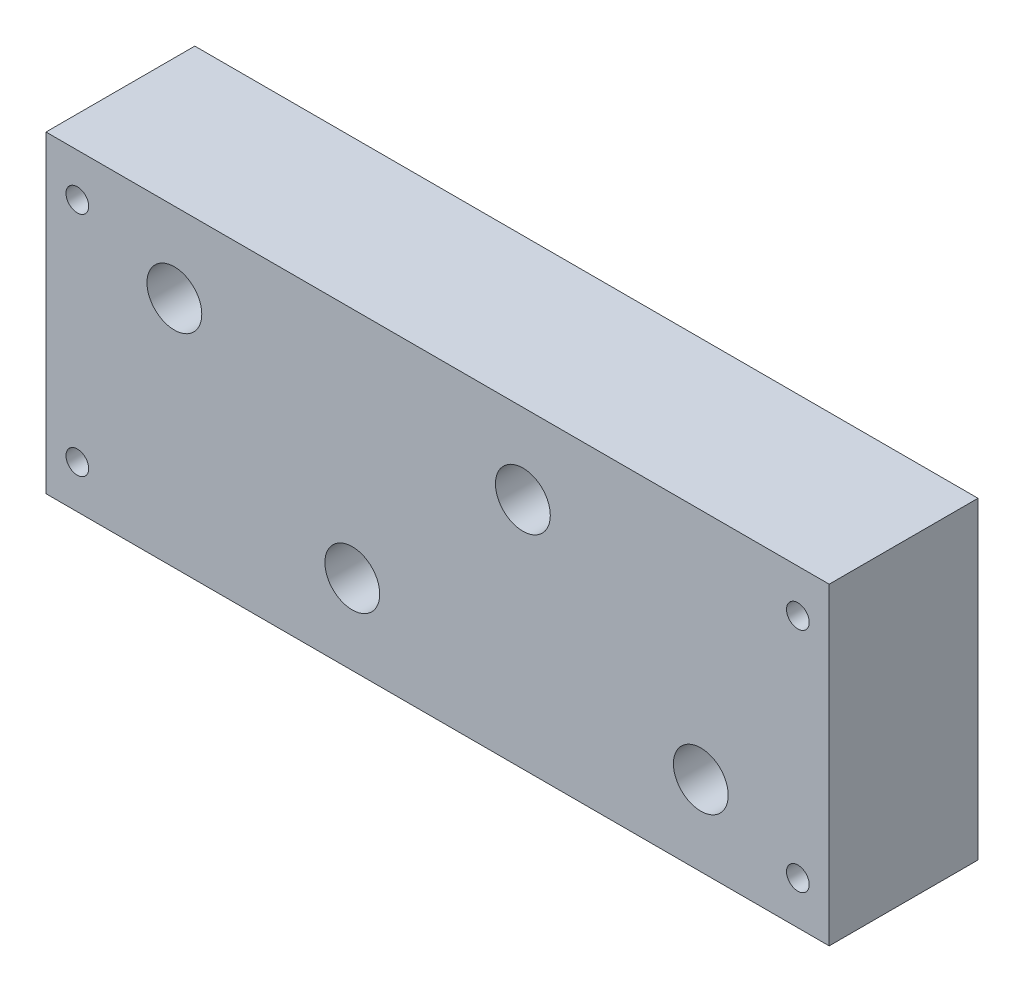
from build123d import *

# Parameters (mm, degrees)
SKETCH1_W           = 100
SKETCH1_H           = 40
BOSS_EXTRUDE1_DEPTH = 38
CUT_EXTRUDE2_START  = -12
SKETCH2_W           = 39.5
SKETCH2_H           = 34
CUT_EXTRUDE2_DEPTH  = 21
CUT_EXTRUDE3_DEPTH  = 9
CUT_EXTRUDE4_REACH  = 81.36
SKETCH4_R           = 1.45
SKETCH5_W           = 100
SKETCH5_H           = 19
CUT_EXTRUDE5_DEPTH  = 87.215210375
FILLET1_R           = 0.5
CUT_EXTRUDE11_REACH = 73.063
SKETCH10_R          = 3.5


with BuildPart() as part:
    # Sketch1 → Boss-Extrude1 (new body)
    with BuildSketch(Plane.XY):
        with Locations((16.25, 1.5625)):
            Rectangle(SKETCH1_W, SKETCH1_H)
    extrude(amount=BOSS_EXTRUDE1_DEPTH)

    # Sketch2 → Cut-Extrude2 (cut)
    with BuildSketch(Plane(origin=(0, 0, 0), x_dir=(-1, 0, 0), z_dir=(0, 0, -1)).offset(CUT_EXTRUDE2_START)):
        with Locations((-38.5, 1.5625)):
            Rectangle(SKETCH2_W, SKETCH2_H)
        with Locations((6, 1.5625)):
            Rectangle(SKETCH2_W, SKETCH2_H)
    extrude(amount=-CUT_EXTRUDE2_DEPTH, mode=Mode.SUBTRACT)

    # Sketch3 → Cut-Extrude3 (cut)
    with BuildSketch(Plane(origin=(-3.362318072, 0, 0), x_dir=(-1, 0, 0), z_dir=(0, 0, -1))):
        with BuildLine():
            ThreePointArc((-61.593370612, 1.614325749), (-20.676836723, -17.421621422), (21.715969185, -1.949710178))
            ThreePointArc((21.715969185, -1.949710178), (22.204299442, 9.465009595), (10.78957967, 9.953339852))
            ThreePointArc((10.78957967, 9.953339852), (-19.986233449, -1.278769909), (-49.690320582, 12.540715264))
            ThreePointArc((-49.690320582, 12.540715264), (-61.105040355, 13.029045522), (-61.593370612, 1.614325749))
        make_face()
    extrude(amount=-CUT_EXTRUDE3_DEPTH, mode=Mode.SUBTRACT)

    # Sketch4 → Cut-Extrude4 (cut, up to next)
    with BuildSketch(Plane(origin=(0, 0, 0), x_dir=(-1, 0, 0), z_dir=(0, 0, -1)), mode=Mode.PRIVATE) as cut_extrude4_sk1:
        with Locations((-62.25, 16.0625)):
            Circle(SKETCH4_R)
    cut_extrude4_tool1 = extrude(cut_extrude4_sk1.sketch, amount=-CUT_EXTRUDE4_REACH, mode=Mode.PRIVATE) & part.part
    # Sketch4 → Cut-Extrude4 (cut, up to next)
    with BuildSketch(Plane(origin=(0, 0, 0), x_dir=(-1, 0, 0), z_dir=(0, 0, -1)), mode=Mode.PRIVATE) as cut_extrude4_sk2:
        with Locations((-62.25, -12.9375)):
            Circle(SKETCH4_R)
    cut_extrude4_tool2 = extrude(cut_extrude4_sk2.sketch, amount=-CUT_EXTRUDE4_REACH, mode=Mode.PRIVATE) & part.part
    # Sketch4 → Cut-Extrude4 (cut, up to next)
    with BuildSketch(Plane(origin=(0, 0, 0), x_dir=(-1, 0, 0), z_dir=(0, 0, -1)), mode=Mode.PRIVATE) as cut_extrude4_sk3:
        with Locations((29.75, 16.0625)):
            Circle(SKETCH4_R)
    cut_extrude4_tool3 = extrude(cut_extrude4_sk3.sketch, amount=-CUT_EXTRUDE4_REACH, mode=Mode.PRIVATE) & part.part
    # Sketch4 → Cut-Extrude4 (cut, up to next)
    with BuildSketch(Plane(origin=(0, 0, 0), x_dir=(-1, 0, 0), z_dir=(0, 0, -1)), mode=Mode.PRIVATE) as cut_extrude4_sk4:
        with Locations((29.75, -12.9375)):
            Circle(SKETCH4_R)
    cut_extrude4_tool4 = extrude(cut_extrude4_sk4.sketch, amount=-CUT_EXTRUDE4_REACH, mode=Mode.PRIVATE) & part.part
    add(cut_extrude4_tool1.solids().sort_by_distance((62.25, 16.0625, 0))[0], mode=Mode.SUBTRACT)
    add(cut_extrude4_tool2.solids().sort_by_distance((62.25, -12.9375, 0))[0], mode=Mode.SUBTRACT)
    add(cut_extrude4_tool3.solids().sort_by_distance((-29.75, 16.0625, 0))[0], mode=Mode.SUBTRACT)
    add(cut_extrude4_tool4.solids().sort_by_distance((-29.75, -12.9375, 0))[0], mode=Mode.SUBTRACT)

    # Sketch5 → Cut-Extrude5 (cut, through all)
    with BuildSketch(Plane(origin=(0, 21.5625, 0), x_dir=(1, 0, 0), z_dir=(0, 1, 0))):
        with Locations((16.25, -9.5)):
            Rectangle(SKETCH5_W, SKETCH5_H)
    extrude(amount=-CUT_EXTRUDE5_DEPTH, mode=Mode.SUBTRACT)

    # Fillet1
    fillet1_edges = [part.edges().sort_by_distance(p)[0] for p in [
        (58.25, 18.5625, 26),
        (18.75, 18.5625, 26),
        (18.75, -15.4375, 26),
        (58.25, -15.4375, 26),
        (13.75, 18.5625, 26),
        (-25.75, 18.5625, 26),
        (-25.75, -15.4375, 26),
        (13.75, -15.4375, 26),
    ]]
    fillet(fillet1_edges, radius=FILLET1_R)

    # Sketch10 → Cut-Extrude11 (cut, up to next)
    with BuildSketch(Plane(origin=(0, 0, 33), x_dir=(-1, 0, 0), z_dir=(0, 0, -1)), mode=Mode.PRIVATE) as cut_extrude11_sk1:
        with Locations((-49.860388068, -8.232477434)):
            Circle(SKETCH10_R)
    cut_extrude11_tool1 = extrude(cut_extrude11_sk1.sketch, amount=-CUT_EXTRUDE11_REACH, mode=Mode.PRIVATE) & part.part
    # Sketch10 → Cut-Extrude11 (cut, up to next)
    with BuildSketch(Plane(origin=(0, 0, 33), x_dir=(-1, 0, 0), z_dir=(0, 0, -1)), mode=Mode.PRIVATE) as cut_extrude11_sk2:
        with Locations((-27.139611932, 11.357477434)):
            Circle(SKETCH10_R)
    cut_extrude11_tool2 = extrude(cut_extrude11_sk2.sketch, amount=-CUT_EXTRUDE11_REACH, mode=Mode.PRIVATE) & part.part
    # Sketch10 → Cut-Extrude11 (cut, up to next)
    with BuildSketch(Plane(origin=(0, 0, 33), x_dir=(-1, 0, 0), z_dir=(0, 0, -1)), mode=Mode.PRIVATE) as cut_extrude11_sk3:
        with Locations((-5.360388068, -8.232477434)):
            Circle(SKETCH10_R)
    cut_extrude11_tool3 = extrude(cut_extrude11_sk3.sketch, amount=-CUT_EXTRUDE11_REACH, mode=Mode.PRIVATE) & part.part
    # Sketch10 → Cut-Extrude11 (cut, up to next)
    with BuildSketch(Plane(origin=(0, 0, 33), x_dir=(-1, 0, 0), z_dir=(0, 0, -1)), mode=Mode.PRIVATE) as cut_extrude11_sk4:
        with Locations((17.360388068, 11.357477434)):
            Circle(SKETCH10_R)
    cut_extrude11_tool4 = extrude(cut_extrude11_sk4.sketch, amount=-CUT_EXTRUDE11_REACH, mode=Mode.PRIVATE) & part.part
    add(cut_extrude11_tool1.solids().sort_by_distance((49.860388, -8.232477, 33))[0], mode=Mode.SUBTRACT)
    add(cut_extrude11_tool2.solids().sort_by_distance((27.139612, 11.357477, 33))[0], mode=Mode.SUBTRACT)
    add(cut_extrude11_tool3.solids().sort_by_distance((5.360388, -8.232477, 33))[0], mode=Mode.SUBTRACT)
    add(cut_extrude11_tool4.solids().sort_by_distance((-17.360388, 11.357477, 33))[0], mode=Mode.SUBTRACT)


solid = part.part
